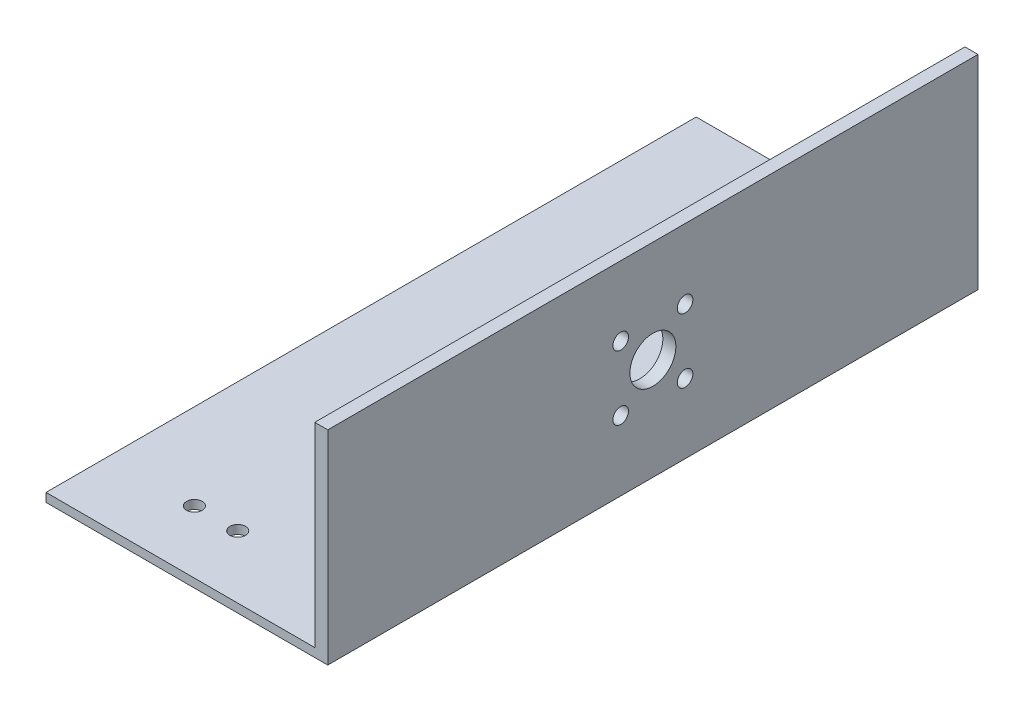
from build123d import *

# Parameters (mm, degrees)
CROQUIS1_W              = 65
CROQUIS1_H              = 150
CROQUIS1_R              = 1.8
SALIENTE_EXTRUIR1_DEPTH = 2
CROQUIS2_W              = 3
CROQUIS2_H              = 150
SALIENTE_EXTRUIR2_DEPTH = 45
CROQUIS3_R              = 5.3
CROQUIS3_R_2            = 1.8
CORTAR_EXTRUIR1_DEPTH   = 10


with BuildPart() as part:
    # Croquis1 → Saliente-Extruir1 (new body)
    with BuildSketch(Plane(origin=(0, 0, 0), x_dir=(1, 0, 0), z_dir=(0, 1, 0))):
        Rectangle(CROQUIS1_W, CROQUIS1_H)
        with Locations(Location((-2.7, 12.25, 0), (0, 0, 270))):
            Circle(CROQUIS1_R, mode=Mode.SUBTRACT)
        with Locations(Location((-2.7, 60.57, 0), (0, 0, 270))):
            Circle(CROQUIS1_R, mode=Mode.SUBTRACT)
        with Locations(Location((-12.7, -60.57, 0), (0, 0, 90))):
            Circle(CROQUIS1_R, mode=Mode.SUBTRACT)
        with Locations(Location((-2.7, -60.57, 0), (0, 0, 90))):
            Circle(CROQUIS1_R, mode=Mode.SUBTRACT)
        with Locations(Location((-12.7, 12.25, 0), (0, 0, 270))):
            Circle(CROQUIS1_R, mode=Mode.SUBTRACT)
        with Locations(Location((-12.7, 60.57, 0), (0, 0, 270))):
            Circle(CROQUIS1_R, mode=Mode.SUBTRACT)
        with Locations(Location((-12.7, -12.25, 0), (0, 0, 90))):
            Circle(CROQUIS1_R, mode=Mode.SUBTRACT)
        with Locations(Location((-2.7, -12.25, 0), (0, 0, 90))):
            Circle(CROQUIS1_R, mode=Mode.SUBTRACT)
    extrude(amount=SALIENTE_EXTRUIR1_DEPTH)

    # Croquis2 → Saliente-Extruir2 (add)
    with BuildSketch(Plane(origin=(0, 2, 0), x_dir=(1, 0, 0), z_dir=(0, 1, 0))):
        with Locations((31, 0)):
            Rectangle(CROQUIS2_W, CROQUIS2_H)
    extrude(amount=SALIENTE_EXTRUIR2_DEPTH)

    # Croquis3 → Cortar-Extruir1 (cut)
    with BuildSketch(Plane(origin=(32.5, 0, 0), x_dir=(0, 0, -1), z_dir=(1, 0, 0))):
        with Locations((0, 23.5)):
            Circle(CROQUIS3_R)
        with Locations((-7.424621202, 16.075378798)):
            Circle(CROQUIS3_R_2)
        with Locations((-7.424621202, 30.924621202)):
            Circle(CROQUIS3_R_2)
        with Locations((7.424621202, 30.924621202)):
            Circle(CROQUIS3_R_2)
        with Locations((7.424621202, 16.075378798)):
            Circle(CROQUIS3_R_2)
    extrude(amount=-CORTAR_EXTRUIR1_DEPTH, mode=Mode.SUBTRACT)


solid = part.part
